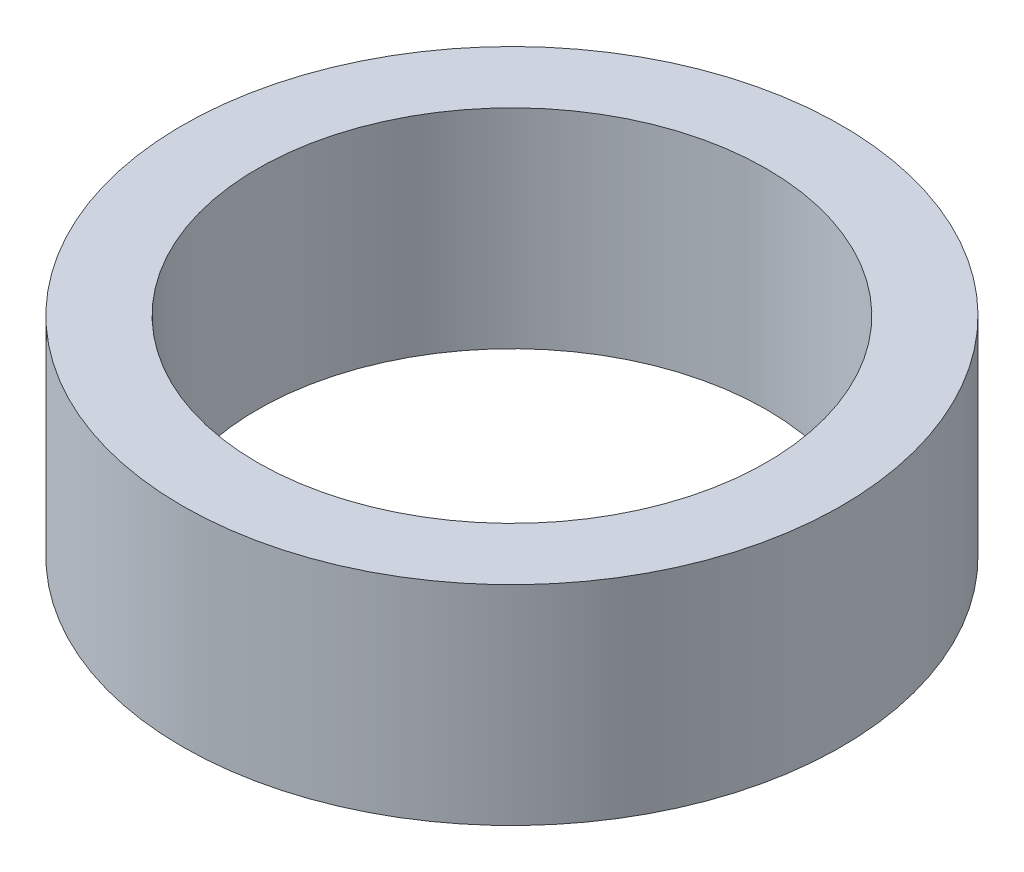
from build123d import *

# Parameters (mm, degrees)
SKETCH1_R           = 7.9
SKETCH1_R_2         = 6.1
BOSS_EXTRUDE1_DEPTH = 5


with BuildPart() as part:
    # Sketch1 → Boss-Extrude1 (new body)
    with BuildSketch(Plane(origin=(0, 0, 0), x_dir=(1, 0, 0), z_dir=(0, 1, 0))):
        with Locations(Location((0, 0, 0), (0, 0, 270))):
            Circle(SKETCH1_R)
        with Locations(Location((0, 0, 0), (0, 0, 270))):
            Circle(SKETCH1_R_2, mode=Mode.SUBTRACT)
    extrude(amount=BOSS_EXTRUDE1_DEPTH)


solid = part.part
